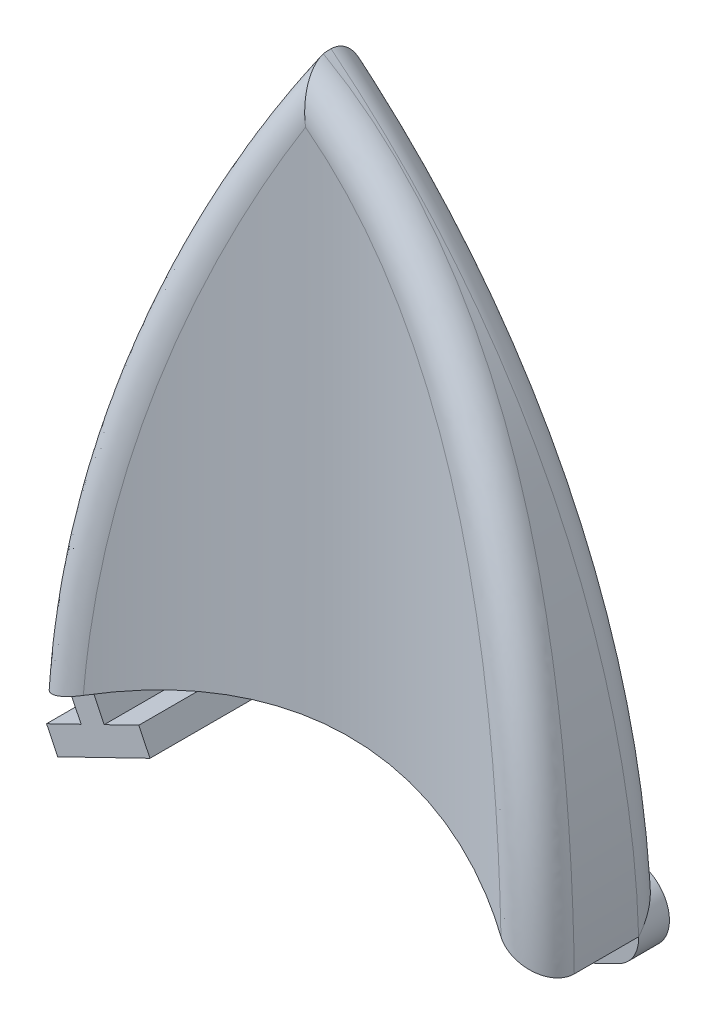
from build123d import *

# Parameters (mm, degrees)
ESBO_O1_W                         = 50
ESBO_O1_H                         = 15
RESSALTO_EXTRUS_O1_DEPTH          = 60
CORTE_EXTRUS_O1_REACH             = 68.708
CORTE_EXTRUS_O1_DIRECTION_2_DEPTH = 67.708320321
CORTE_EXTRUS_O2_REACH             = 68.708
CORTE_EXTRUS_O3_DEPTH             = 60
FILETE1_R                         = 3
CORTE_EXTRUS_O4_REACH             = 68.15
RESSALTO_EXTRUS_O2_DEPTH          = 3
RESSALTO_EXTRUS_O5_DEPTH          = 10
CORTE_EXTRUS_O5_REACH             = 68.436
ESBO_O13_R                        = 1.75


with BuildPart() as part:
    # Esboço1 → Ressalto-extrusão1 (new body)
    with BuildSketch(Plane(origin=(0, 0, 0), x_dir=(1, 0, 0), z_dir=(0, 1, 0))):
        with Locations((0, -7.5)):
            Rectangle(ESBO_O1_W, ESBO_O1_H)
    extrude(amount=RESSALTO_EXTRUS_O1_DEPTH)

    # Esboço2 → Corte-extrusão1 (cut, up to next)
    with BuildSketch(Plane.XY, mode=Mode.PRIVATE) as corte_extrus_o1_sk1:
        with BuildLine():
            Line((-5, 60), (-25, 60))
            Line((-25, 60), (-25, 0))
            ThreePointArc((-25, 0), (-19.26833423, 31.422778077), (-5, 60))
        make_face()
    corte_extrus_o1_tool1 = extrude(corte_extrus_o1_sk1.sketch, amount=CORTE_EXTRUS_O1_REACH, mode=Mode.PRIVATE) & part.part
    add(corte_extrus_o1_tool1.solids().sort_by_distance((-19.088208, 44.385781, 0))[0], mode=Mode.SUBTRACT)

    # Esboço2 → Corte-extrusão1 direction 2 (cut)
    with BuildSketch(Plane.XY):
        with BuildLine():
            Line((-5, 60), (-25, 60))
            Line((-25, 60), (-25, 0))
            ThreePointArc((-25, 0), (-19.26833423, 31.422778077), (-5, 60))
        make_face()
    extrude(amount=-CORTE_EXTRUS_O1_DIRECTION_2_DEPTH, mode=Mode.SUBTRACT)

    # Esboço3 → Corte-extrusão2 (cut, up to next)
    with BuildSketch(Plane(origin=(0, 0, 0), x_dir=(-1, 0, 0), z_dir=(0, 0, -1)), mode=Mode.PRIVATE) as corte_extrus_o2_sk1:
        with BuildLine():
            Line((5, 60), (-25, 60))
            Line((-25, 60), (-25, 0))
            ThreePointArc((-25, 0), (-16.592648204, 33.296324102), (5, 60))
        make_face()
    corte_extrus_o2_tool1 = extrude(corte_extrus_o2_sk1.sketch, amount=-CORTE_EXTRUS_O2_REACH, mode=Mode.PRIVATE) & part.part
    add(corte_extrus_o2_tool1.solids().sort_by_distance((16.380123, 45.090511, 0))[0], mode=Mode.SUBTRACT)

    # Esboço4 → Corte-extrusão3 (cut)
    with BuildSketch(Plane.XZ):
        with BuildLine():
            Line((-25, 15), (25, 15))
            ThreePointArc((25, 15), (0, 6.224989992), (-25, 15))
        make_face()
    extrude(amount=-CORTE_EXTRUS_O3_DEPTH, mode=Mode.SUBTRACT)

    # Filete1
    filete1_edges = [part.edges().sort_by_distance(p)[0] for p in [
        (-19.26833423, 31.422778077, 0),
        (16.592648204, 33.296324102, 0),
        (16.624702652, 33.232143265, 9.843411386),
        (-19.254067777, 31.465549051, 11.163888014),
    ]]
    fillet(filete1_edges, radius=FILETE1_R)

    # Esboço5 → Corte-extrusão4 (cut, up to next)
    with BuildSketch(Plane.XY, mode=Mode.PRIVATE) as corte_extrus_o4_sk1:
        with BuildLine():
            Line((-25, 0), (25, 0))
            ThreePointArc((25, 0), (0, 6.010205144), (-25, 0))
        make_face()
    corte_extrus_o4_tool1 = extrude(corte_extrus_o4_sk1.sketch, amount=CORTE_EXTRUS_O4_REACH, mode=Mode.PRIVATE) & part.part
    add(corte_extrus_o4_tool1.solids().sort_by_distance((0, 2.415709, 0))[0], mode=Mode.SUBTRACT)

    # Esboço7 → Ressalto-extrusão2 (add)
    with BuildSketch(Plane(origin=(0, 0, 0), x_dir=(-1, 0, 0), z_dir=(0, 0, -1))):
        with BuildLine():
            Line((-19.972876931, 3.039918822), (-12.7764147, -0.454495485))
            ThreePointArc((-12.7764147, -0.454495485), (-11.156768732, -5.131753971), (-15.834027218, -6.751399938))
            Line((-15.834027218, -6.751399938), (-23.03048945, -3.256985631))
            ThreePointArc((-23.03048945, -3.256985631), (-24.650135417, 1.420272855), (-19.972876931, 3.039918822))
        make_face()
    extrude(amount=-RESSALTO_EXTRUS_O2_DEPTH)

    # Esboço12 → Ressalto-extrusão5 (add)
    with BuildSketch(Plane(origin=(0, 0, 0), x_dir=(-1, 0, 0), z_dir=(0, 0, -1))):
        Polygon((24.120879113, 1.357076315), (22.37367196, -2.241154801), (25.747013631, -3.879161507), (24.65500916, -6.128055954), (15.659431371, -1.760038071), (16.751435841, 0.488856377), (20.124777513, -1.14915033), (21.871984666, 2.449080786), align=None)
    extrude(amount=-RESSALTO_EXTRUS_O5_DEPTH)

    # Esboço13 → Corte-extrusão5 (cut, up to next)
    with BuildSketch(Plane(origin=(0, 0, 0), x_dir=(-1, 0, 0), z_dir=(0, 0, -1)), mode=Mode.PRIVATE) as corte_extrus_o5_sk1:
        with Locations((-14.305220959, -3.602947712)):
            Circle(ESBO_O13_R)
    corte_extrus_o5_tool1 = extrude(corte_extrus_o5_sk1.sketch, amount=-CORTE_EXTRUS_O5_REACH, mode=Mode.PRIVATE) & part.part
    add(corte_extrus_o5_tool1.solids().sort_by_distance((14.305221, -3.602948, 0))[0], mode=Mode.SUBTRACT)


solid = part.part
